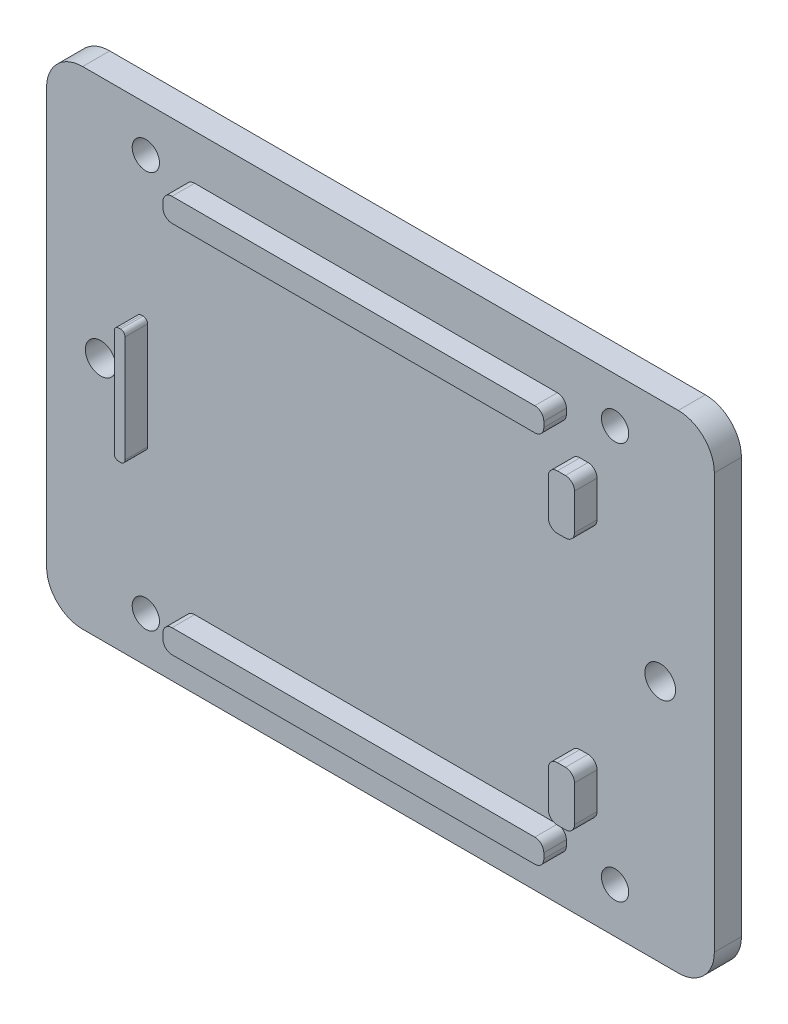
from build123d import *

# Parameters (mm, degrees)
OUTER_BED_74X54X3_SKETCH_R        = 1.51
OUTER_BED_74X54X3_SKETCH_R_2      = 1.7
OUTER_BED_74X54X3_DEPTH           = 3
FACTORY_CASE_LOCATING_STOPS_START = 3
FACTORY_CASE_LOCATING_STOPS_DEPTH = 2.5


with BuildPart() as part:
    # Outer_bed_74x54x3_Sketch → Outer_bed_74x54x3 (new body)
    with BuildSketch(Plane.XY):
        with BuildLine():
            Line((-33, -27), (33, -27))
            ThreePointArc((33, -27), (35.828427125, -25.828427125), (37, -23))
            Line((37, -23), (37, 23))
            ThreePointArc((37, 23), (35.828427125, 25.828427125), (33, 27))
            Line((33, 27), (-33, 27))
            ThreePointArc((-33, 27), (-35.828427125, 25.828427125), (-37, 23))
            Line((-37, 23), (-37, -23))
            ThreePointArc((-37, -23), (-35.828427125, -25.828427125), (-33, -27))
        make_face()
        with Locations((-26, -22)):
            Circle(OUTER_BED_74X54X3_SKETCH_R, mode=Mode.SUBTRACT)
        with Locations((-26, 22)):
            Circle(OUTER_BED_74X54X3_SKETCH_R, mode=Mode.SUBTRACT)
        with Locations((26, -22)):
            Circle(OUTER_BED_74X54X3_SKETCH_R, mode=Mode.SUBTRACT)
        with Locations((26, 22)):
            Circle(OUTER_BED_74X54X3_SKETCH_R, mode=Mode.SUBTRACT)
        with Locations((-31, 0)):
            Circle(OUTER_BED_74X54X3_SKETCH_R_2, mode=Mode.SUBTRACT)
        with Locations((31, 0)):
            Circle(OUTER_BED_74X54X3_SKETCH_R_2, mode=Mode.SUBTRACT)
    extrude(amount=OUTER_BED_74X54X3_DEPTH)

    # Factory_case_locating_stops_Sketch → Factory_case_locating_stops (add)
    with BuildSketch(Plane.XY.offset(FACTORY_CASE_LOCATING_STOPS_START)):
        with BuildLine():
            Line((-20.6, -22), (19.6, -22))
            ThreePointArc((19.6, -22), (20.307106781, -21.707106781), (20.6, -21))
            Line((20.6, -21), (20.6, -20.4))
            ThreePointArc((20.6, -20.4), (20.307106781, -19.692893219), (19.6, -19.4))
            Line((19.6, -19.4), (-20.6, -19.4))
            ThreePointArc((-20.6, -19.4), (-21.307106781, -19.692893219), (-21.6, -20.4))
            Line((-21.6, -20.4), (-21.6, -21))
            ThreePointArc((-21.6, -21), (-21.307106781, -21.707106781), (-20.6, -22))
        make_face()
        with BuildLine():
            Line((-20.6, 19.4), (19.6, 19.4))
            ThreePointArc((19.6, 19.4), (20.307106781, 19.692893219), (20.6, 20.4))
            Line((20.6, 20.4), (20.6, 21))
            ThreePointArc((20.6, 21), (20.307106781, 21.707106781), (19.6, 22))
            Line((19.6, 22), (-20.6, 22))
            ThreePointArc((-20.6, 22), (-21.307106781, 21.707106781), (-21.6, 21))
            Line((-21.6, 21), (-21.6, 20.4))
            ThreePointArc((-21.6, 20.4), (-21.307106781, 19.692893219), (-20.6, 19.4))
        make_face()
        with BuildLine():
            Line((-26.5, -6.4), (-26.3, -6.4))
            ThreePointArc((-26.3, -6.4), (-25.946446609, -6.253553391), (-25.8, -5.9))
            Line((-25.8, -5.9), (-25.8, 5.9))
            ThreePointArc((-25.8, 5.9), (-25.946446609, 6.253553391), (-26.3, 6.4))
            Line((-26.3, 6.4), (-26.5, 6.4))
            ThreePointArc((-26.5, 6.4), (-26.853553391, 6.253553391), (-27, 5.9))
            Line((-27, 5.9), (-27, -5.9))
            ThreePointArc((-27, -5.9), (-26.853553391, -6.253553391), (-26.5, -6.4))
        make_face()
        with BuildLine():
            Line((22.1, -17), (23, -17))
            ThreePointArc((23, -17), (23.707106781, -16.707106781), (24, -16))
            Line((24, -16), (24, -12))
            ThreePointArc((24, -12), (23.707106781, -11.292893219), (23, -11))
            Line((23, -11), (22.1, -11))
            ThreePointArc((22.1, -11), (21.392893219, -11.292893219), (21.1, -12))
            Line((21.1, -12), (21.1, -16))
            ThreePointArc((21.1, -16), (21.392893219, -16.707106781), (22.1, -17))
        make_face()
        with BuildLine():
            Line((22.1, 11), (23, 11))
            ThreePointArc((23, 11), (23.707106781, 11.292893219), (24, 12))
            Line((24, 12), (24, 16))
            ThreePointArc((24, 16), (23.707106781, 16.707106781), (23, 17))
            Line((23, 17), (22.1, 17))
            ThreePointArc((22.1, 17), (21.392893219, 16.707106781), (21.1, 16))
            Line((21.1, 16), (21.1, 12))
            ThreePointArc((21.1, 12), (21.392893219, 11.292893219), (22.1, 11))
        make_face()
    extrude(amount=FACTORY_CASE_LOCATING_STOPS_DEPTH)


solid = part.part
